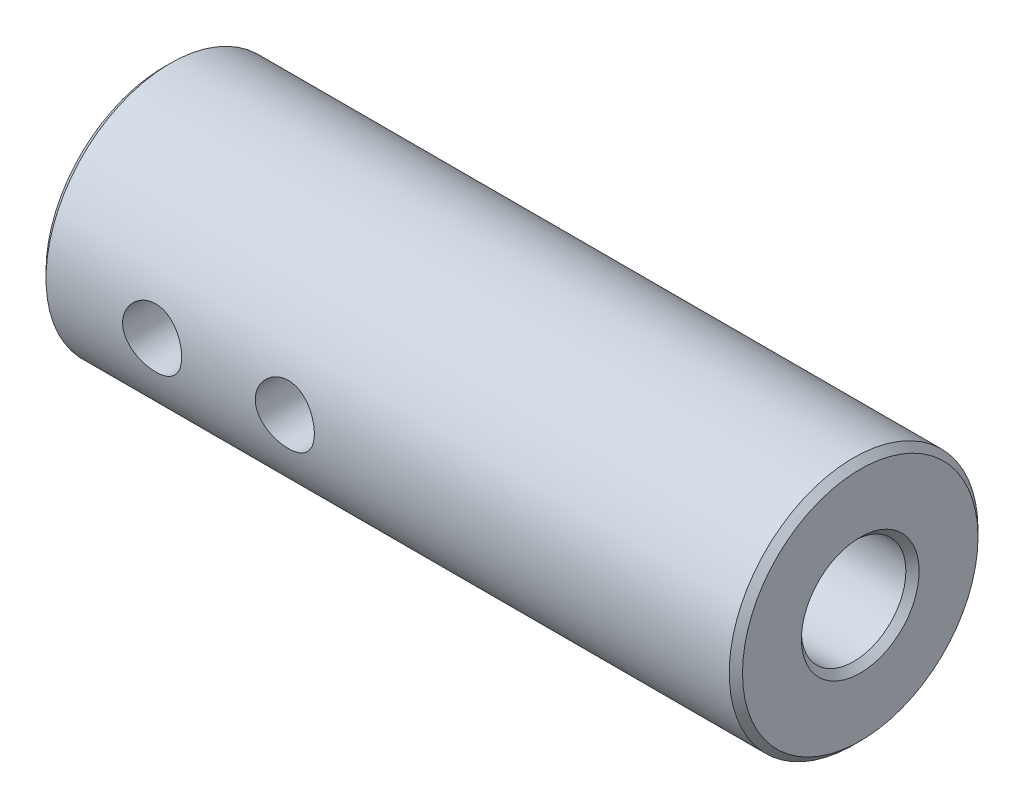
from build123d import *

# Parameters (mm, degrees)
SKETCH1_R                  = 4.7625
BOSS_EXTRUDE1_DEPTH        = 13.335
SKETCH2_R                  = 2
CUT_EXTRUDE1_DEPTH         = 28.507302894
F_4_40_TAPPED_HOLE1_REACH  = 19.065
F_4_40_TAPPED_HOLE1_BORE_R = 1.1303
CUT_EXTRUDE2_DEPTH         = 1.190625
CHAMFER1_SIZE              = 0.254


with BuildPart() as part:
    # Sketch1 → Boss-Extrude1 (new, symmetric)
    with BuildSketch(Plane(origin=(0, 0, 0), x_dir=(0, 0, -1), z_dir=(1, 0, 0))):
        Circle(SKETCH1_R)
    extrude(amount=BOSS_EXTRUDE1_DEPTH, both=True)

    # Sketch2 → Cut-Extrude1 (cut, through all)
    with BuildSketch(Plane(origin=(13.335, 0, 0), x_dir=(0, 0, -1), z_dir=(1, 0, 0))):
        Circle(SKETCH2_R)
    extrude(amount=-CUT_EXTRUDE1_DEPTH, mode=Mode.SUBTRACT)

    # #4-40 Tapped Hole1 bore → #4-40 Tapped Hole1 (cut, up to next)
    with BuildSketch(Plane.XY.offset(4.7625), mode=Mode.PRIVATE) as f_4_40_tapped_hole1_sk1:
        with Locations((-9.017, 0)):
            Circle(F_4_40_TAPPED_HOLE1_BORE_R)
    f_4_40_tapped_hole1_tool1 = extrude(f_4_40_tapped_hole1_sk1.sketch, amount=-F_4_40_TAPPED_HOLE1_REACH, mode=Mode.PRIVATE) & part.part
    # #4-40 Tapped Hole1 bore → #4-40 Tapped Hole1 (cut, up to next)
    with BuildSketch(Plane.XY.offset(4.7625), mode=Mode.PRIVATE) as f_4_40_tapped_hole1_sk2:
        with Locations((-3.937, 0)):
            Circle(F_4_40_TAPPED_HOLE1_BORE_R)
    f_4_40_tapped_hole1_tool2 = extrude(f_4_40_tapped_hole1_sk2.sketch, amount=-F_4_40_TAPPED_HOLE1_REACH, mode=Mode.PRIVATE) & part.part
    add(f_4_40_tapped_hole1_tool1.solids().sort_by_distance((-9.017, 0, 4.7625))[0], mode=Mode.SUBTRACT)
    add(f_4_40_tapped_hole1_tool2.solids().sort_by_distance((-3.937, 0, 4.7625))[0], mode=Mode.SUBTRACT)

    # Sketch7 → Cut-Extrude2 (cut)
    with BuildSketch(Plane(origin=(0, 0, -4.7625), x_dir=(-1, 0, 0), z_dir=(0, 0, -1))):
        with BuildLine():
            Line((-4.7625, 1.190625), (7.9375, 1.190625))
            ThreePointArc((7.9375, 1.190625), (9.128125, 0), (7.9375, -1.190625))
            Line((7.9375, -1.190625), (-4.7625, -1.190625))
            ThreePointArc((-4.7625, -1.190625), (-5.953125, 0), (-4.7625, 1.190625))
        make_face()
    extrude(amount=-CUT_EXTRUDE2_DEPTH, mode=Mode.SUBTRACT)

    # Chamfer1
    chamfer1_edges = [part.edges().sort_by_distance(p)[0] for p in [
        (-13.335, 0, 4.7625),
        (13.335, 0, 4.7625),
        (-13.335, 0, 2),
        (13.335, 0, 2),
    ]]
    chamfer(chamfer1_edges, length=CHAMFER1_SIZE)


solid = part.part
